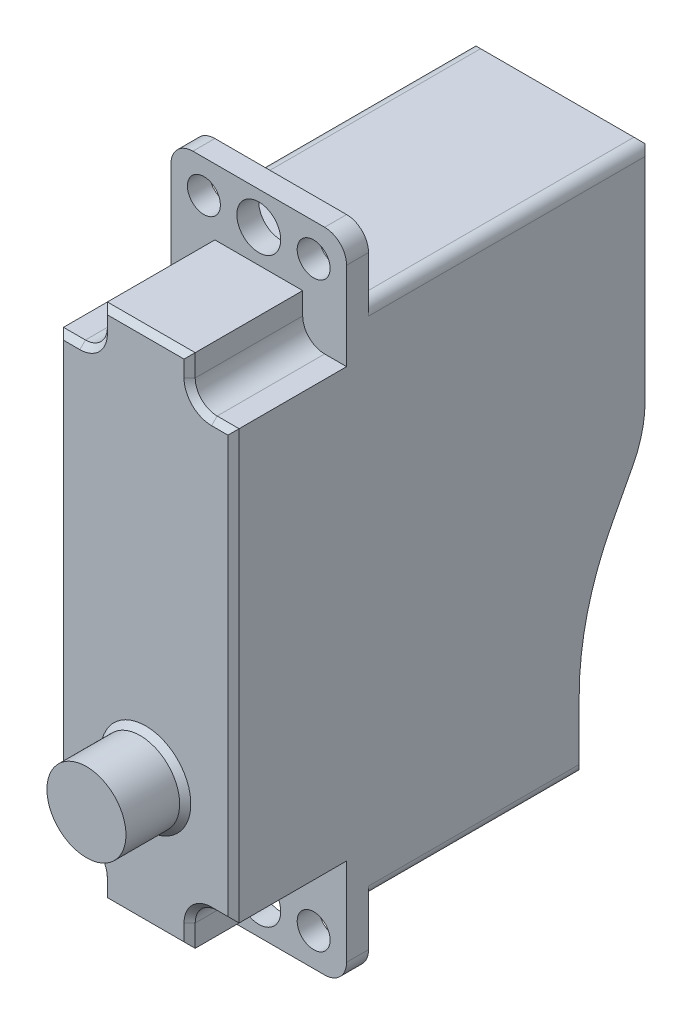
from build123d import *

# Parameters (mm, degrees)
BOSS_EXTRUDE1_DEPTH = 8
SKETCH2_R           = 1
SKETCH2_R_2         = 0.75
CUT_EXTRUDE1_DEPTH  = 31.952746243
FILLET1_R           = 1
SKETCH3_R           = 1.8
BOSS_EXTRUDE2_DEPTH = 2.7
CUT_EXTRUDE2_DEPTH  = 5.15
CHAMFER1_SIZE       = 0.254
CHAMFER2_SIZE       = 0.254
FILLET2_R           = 0.508


with BuildPart() as part:
    # Sketch1 → Boss-Extrude1 (new body)
    with BuildSketch(Plane.YZ):
        with BuildLine():
            Line((0, 0), (23.5, 0))
            Line((23.5, 0), (23.5, -5.15))
            Line((23.5, -5.15), (26.5, -5.15))
            Line((26.5, -5.15), (26.5, -6.15))
            Line((26.5, -6.15), (23.5, -6.15))
            Line((23.5, -6.15), (23.5, -19))
            Line((23.5, -19), (13.321336499, -19))
            ThreePointArc((13.321336499, -19), (12.106318726, -18.852558343), (10.961830178, -18.418792051))
            Line((10.961830178, -18.418792051), (9.120424555, -17.453019871))
            ThreePointArc((9.120424555, -17.453019871), (6.259203186, -16.368604142), (3.221658753, -16))
            Line((3.221658753, -16), (0, -16))
            Line((0, -16), (0, -6.15))
            Line((0, -6.15), (-3, -6.15))
            Line((-3, -6.15), (-3, -5.15))
            Line((-3, -5.15), (0, -5.15))
            Line((0, -5.15), (0, 0))
        make_face()
    extrude(amount=BOSS_EXTRUDE1_DEPTH)

    # Sketch2 → Cut-Extrude1 (cut, through all)
    with BuildSketch(Plane.XY.offset(-5.15)):
        with Locations((4, -1.5)):
            Circle(SKETCH2_R)
        with Locations((4, 25)):
            Circle(SKETCH2_R)
        with Locations((6.5, 25)):
            Circle(SKETCH2_R_2)
        with Locations((1.5, 25)):
            Circle(SKETCH2_R_2)
        with Locations((1.5, -1.5)):
            Circle(SKETCH2_R_2)
        with Locations((6.5, -1.5)):
            Circle(SKETCH2_R_2)
    extrude(amount=-CUT_EXTRUDE1_DEPTH, mode=Mode.SUBTRACT)

    # Fillet1
    fillet1_edges = [part.edges().sort_by_distance(p)[0] for p in [
        (8, -3, -5.65),
        (0, 26.5, -5.65),
        (0, -3, -5.65),
        (8, 26.5, -5.65),
    ]]
    fillet(fillet1_edges, radius=FILLET1_R)

    # Sketch3 → Boss-Extrude2 (add)
    with BuildSketch(Plane.XY):
        with Locations(Location((4, 5.85, 0), (0, 0, 180))):
            Circle(SKETCH3_R)
    extrude(amount=BOSS_EXTRUDE2_DEPTH)

    # Sketch4 → Cut-Extrude2 (cut)
    with BuildSketch(Plane.XY):
        with BuildLine():
            Line((0, 23.5), (2, 23.5))
            Line((2, 23.5), (2, 22.5))
            ThreePointArc((2, 22.5), (1.707106781, 21.792893219), (1, 21.5))
            Line((1, 21.5), (0, 21.5))
            Line((0, 21.5), (0, 23.5))
        make_face()
        with BuildLine():
            Line((8, 23.5), (6, 23.5))
            Line((6, 23.5), (6, 22.5))
            ThreePointArc((6, 22.5), (6.292893219, 21.792893219), (7, 21.5))
            Line((7, 21.5), (8, 21.5))
            Line((8, 21.5), (8, 23.5))
        make_face()
        with BuildLine():
            Line((0, 0), (2, 0))
            Line((2, 0), (2, 1))
            ThreePointArc((2, 1), (1.707106781, 1.707106781), (1, 2))
            Line((1, 2), (0, 2))
            Line((0, 2), (0, 0))
        make_face()
        with BuildLine():
            Line((8, 0), (6, 0))
            Line((6, 0), (6, 1))
            ThreePointArc((6, 1), (6.292893219, 1.707106781), (7, 2))
            Line((7, 2), (8, 2))
            Line((8, 2), (8, 0))
        make_face()
    extrude(amount=-CUT_EXTRUDE2_DEPTH, mode=Mode.SUBTRACT)

    # Chamfer1
    chamfer1_edges = [part.edges().sort_by_distance(p)[0] for p in [
        (5.8, 5.85, 0),
        (0, 11.75, 0),
        (8, 11.75, 0),
        (4, 0, 0),
        (4, 23.5, 0),
        (6, 23, 0),
        (6.292893219, 21.792893219, 0),
        (7.5, 21.5, 0),
        (2, 0.5, 0),
        (1.707106781, 1.707106781, 0),
        (0.5, 2, 0),
        (7.5, 2, 0),
        (6.292893219, 1.707106781, 0),
        (6, 0.5, 0),
        (0.5, 21.5, 0),
        (1.707106781, 21.792893219, 0),
        (2, 23, 0),
    ]]
    chamfer(chamfer1_edges, length=CHAMFER1_SIZE)

    # Chamfer2
    chamfer2_edges = [part.edges().sort_by_distance(p)[0] for p in [
        (0, 18.410668249, -19),
        (0, 12.106318726, -18.852558343),
        (0, 10.041127366, -17.935905961),
        (0, 6.259203186, -16.368604142),
        (0, 1.610829376, -16),
        (8, 1.610829376, -16),
        (4, 23.5, -19),
        (4, 0, -16),
        (8, 6.259203186, -16.368604142),
        (8, 10.041127366, -17.935905961),
        (8, 12.106318726, -18.852558343),
        (8, 18.410668249, -19),
    ]]
    chamfer(chamfer2_edges, length=CHAMFER2_SIZE)

    # Fillet2
    fillet2_edges = [part.edges().sort_by_distance(p)[0] for p in [
        (0, 0, -10.948),
        (8, 0, -10.948),
        (0, 23.5, -12.448),
        (8, 23.5, -12.448),
    ]]
    fillet(fillet2_edges, radius=FILLET2_R)


solid = part.part
